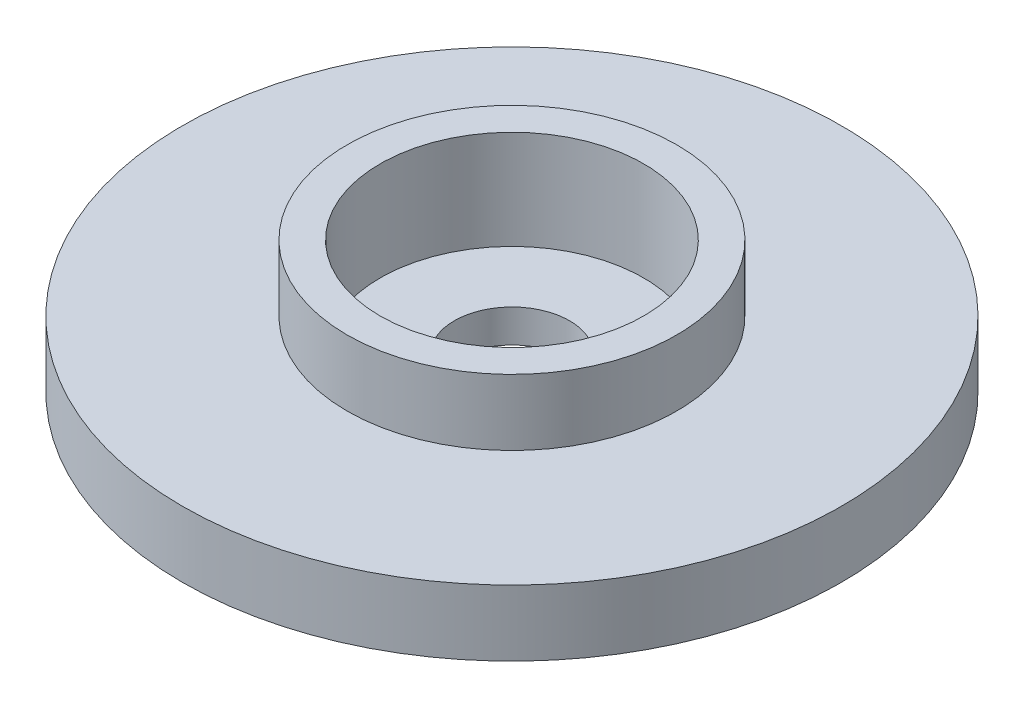
from build123d import *

# Parameters (mm, degrees)
SKETCH_1_R          = 10
EXTRUDE_1_DEPTH     = 2
SKETCH_2_R          = 5
EXTRUDE_2_DEPTH     = 2
SKETCH_3_R          = 1.75
CUT_EXTRUDE_1_DEPTH = 15.696938457
SKETCH_4_R          = 4
CUT_EXTRUDE_2_DEPTH = 3


with BuildPart() as part:
    # 草图1 → 凸台-拉伸1 (new body)
    with BuildSketch(Plane(origin=(0, 0, 0), x_dir=(1, 0, 0), z_dir=(0, 1, 0))):
        with Locations(Location((0, 0, 0), (0, 0, 270))):
            Circle(SKETCH_1_R)
    extrude(amount=EXTRUDE_1_DEPTH)

    # 草图2 → 凸台-拉伸2 (add)
    with BuildSketch(Plane(origin=(0, 2, 0), x_dir=(1, 0, 0), z_dir=(0, 1, 0))):
        with Locations(Location((0, 0, 0), (0, 0, 270))):
            Circle(SKETCH_2_R)
    extrude(amount=EXTRUDE_2_DEPTH)

    # 草图3 → 切除-拉伸1 (cut, through all)
    with BuildSketch(Plane(origin=(0, 4, 0), x_dir=(1, 0, 0), z_dir=(0, 1, 0))):
        with Locations(Location((0, 0, 0), (0, 0, 270))):
            Circle(SKETCH_3_R)
    extrude(amount=-CUT_EXTRUDE_1_DEPTH, mode=Mode.SUBTRACT)

    # 草图4 → 切除-拉伸2 (cut)
    with BuildSketch(Plane(origin=(0, 4, 0), x_dir=(1, 0, 0), z_dir=(0, 1, 0))):
        with Locations(Location((0, 0, 0), (0, 0, 270))):
            Circle(SKETCH_4_R)
    extrude(amount=-CUT_EXTRUDE_2_DEPTH, mode=Mode.SUBTRACT)


solid = part.part
